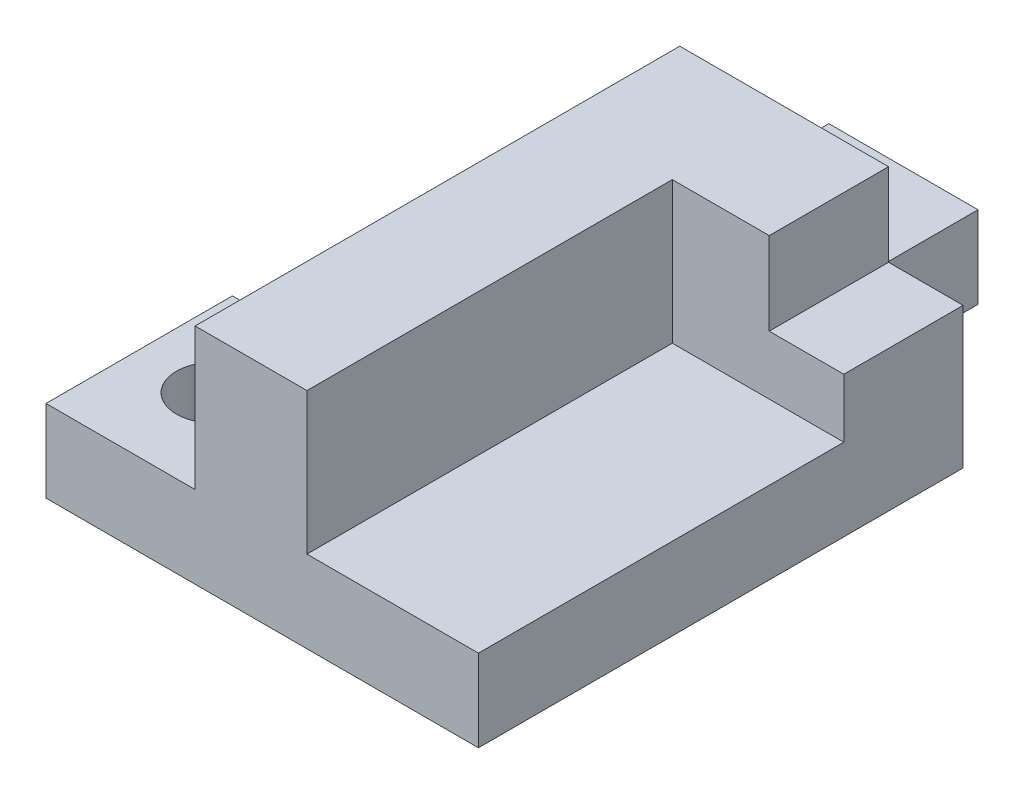
from build123d import *

# Parameters (mm, degrees)
SKETCH1_W               = 369
SKETCH1_H               = 200
BOSS_EXTRUDE1_DEPTH     = 20
SKETCH2_W               = 129
SKETCH2_H               = 16
BOSS_EXTRUDE2_DEPTH     = 10
SKETCH3_W               = 342
SKETCH3_H               = 168
CUT_EXTRUDE1_DEPTH      = 9
SKETCH4_W               = 100
SKETCH4_H               = 10
BOSS_EXTRUDE3_DEPTH     = 60
CUT_EXTRUDE3_DEPTH      = 10
CUT_EXTRUDE3_DEPTH_BACK = 60
SKETCH10_W              = 404
SKETCH10_H              = 324.796202869
CUT_EXTRUDE4_DEPTH      = 69
CUT_EXTRUDE7_DEPTH      = 274.752168941
CUT_EXTRUDE7_DEPTH_BACK = 274.752168941
SKETCH14_W              = 37
SKETCH14_H              = 34.717467541
SKETCH12_W              = 50
SKETCH12_H              = 11
BOSS_EXTRUDE6_DEPTH     = 20
SKETCH13_R              = 4
CUT_EXTRUDE6_DEPTH      = 229.43215623
CORTAR_EXTRUIR4_DEPTH   = 220
CROQUIS5_W              = 20
CROQUIS5_H              = 11
SALIENTE_EXTRUIR2_DEPTH = 10
CROQUIS6_W              = 20
CROQUIS6_H              = 11
SALIENTE_EXTRUIR3_DEPTH = 20
CROQUIS8_R              = 5
CORTAR_EXTRUIR5_DEPTH   = 48
CROQUIS9_W              = 38
CROQUIS9_H              = 65
CORTAR_EXTRUIR6_DEPTH   = 85


with BuildPart() as part:
    # Sketch1 → Boss-Extrude1 (new body)
    with BuildSketch(Plane(origin=(0, 0, 0), x_dir=(1, 0, 0), z_dir=(0, 1, 0))):
        Rectangle(SKETCH1_W, SKETCH1_H)
    extrude(amount=BOSS_EXTRUDE1_DEPTH)

    # Sketch2 → Boss-Extrude2 (add)
    with BuildSketch(Plane(origin=(0, 20, 0), x_dir=(1, 0, 0), z_dir=(0, 1, 0))):
        Polygon((-184.5, -100), (-169.5, -100), (-119.5, -100), (-119.5, -84), (-169.5, -84), (-169.5, -35), (-184.5, -35), align=None)
        Polygon((-184.5, 100), (-169.5, 100), (-119.5, 100), (-119.5, 84), (-169.5, 84), (-169.5, 35), (-184.5, 35), align=None)
        with Locations((20, -92)):
            Rectangle(SKETCH2_W, SKETCH2_H)
        with Locations((20, 92)):
            Rectangle(SKETCH2_W, SKETCH2_H)
    extrude(amount=BOSS_EXTRUDE2_DEPTH)

    # Sketch3 → Cut-Extrude1 (cut)
    with BuildSketch(Plane(origin=(0, 20, 0), x_dir=(1, 0, 0), z_dir=(0, 1, 0))):
        with Locations((1.5, 0)):
            Rectangle(SKETCH3_W, SKETCH3_H)
    extrude(amount=-CUT_EXTRUDE1_DEPTH, mode=Mode.SUBTRACT)

    # Sketch4 → Boss-Extrude3 (add)
    with BuildSketch(Plane(origin=(0, 0, -100), x_dir=(-1, 0, 0), z_dir=(0, 0, -1))):
        with Locations((-19.5, 25)):
            Rectangle(SKETCH4_W, SKETCH4_H)
    extrude(amount=BOSS_EXTRUDE3_DEPTH)

    # Sketch6 → Cut-Extrude3 (cut, two sides: drawn at the far end of the back side and taken through both)
    with BuildSketch(Plane.XY.offset(-84).offset(-CUT_EXTRUDE3_DEPTH_BACK)):
        with BuildLine():
            Line((-24.5, 30), (-26.030765637, 28.081051534))
            ThreePointArc((-26.030765637, 28.081051534), (-26.158442873, 26.948989892), (-25.193843525, 26.342843758))
            Line((-25.193843525, 26.342843758), (-15.806155854, 26.342843758))
            ThreePointArc((-15.806155854, 26.342843758), (-14.841556992, 26.948990172), (-14.969234363, 28.081051534))
            Line((-14.969234363, 28.081051534), (-16.5, 30))
            Line((-16.5, 30), (-24.5, 30))
        make_face()
        with BuildLine():
            Line((56.5, 30), (54.981983491, 27.801494438))
            ThreePointArc((54.981983491, 27.801494438), (54.9192914, 26.767046688), (55.80615587, 26.230871478))
            Line((55.80615587, 26.230871478), (65.193843541, 26.230871478))
            ThreePointArc((65.193843541, 26.230871478), (66.080708464, 26.767046428), (66.018016509, 27.801494438))
            Line((66.018016509, 27.801494438), (64.5, 30))
            Line((64.5, 30), (56.5, 30))
        make_face()
    extrude(amount=CUT_EXTRUDE3_DEPTH + CUT_EXTRUDE3_DEPTH_BACK, mode=Mode.SUBTRACT)

    # Sketch10 → Cut-Extrude4 (cut)
    with BuildSketch(Plane(origin=(0, 30, 0), x_dir=(1, 0, 0), z_dir=(0, 1, 0))):
        with Locations((55.5, -0.89352463)):
            Rectangle(SKETCH10_W, SKETCH10_H)
    extrude(amount=-CUT_EXTRUDE4_DEPTH, mode=Mode.SUBTRACT)

    # Sketch14 → Cut-Extrude7 (cut, two sides: drawn at the far end of the back side and taken through both)
    with BuildSketch(Plane(origin=(0, 0, -100), x_dir=(-1, 0, 0), z_dir=(0, 0, -1)).offset(-CUT_EXTRUDE7_DEPTH_BACK)):
        with Locations((138, 36.253686327)):
            Rectangle(SKETCH14_W, SKETCH14_H)
    extrude(amount=CUT_EXTRUDE7_DEPTH + CUT_EXTRUDE7_DEPTH_BACK, mode=Mode.SUBTRACT)

    # Sketch12 → Boss-Extrude6 (add)
    with BuildSketch(Plane.ZY.offset(184.5)):
        with Locations((-25, 5.5)):
            Rectangle(SKETCH12_W, SKETCH12_H)
    extrude(amount=BOSS_EXTRUDE6_DEPTH)

    # Sketch13 → Cut-Extrude6 (cut, through all)
    with BuildSketch(Plane(origin=(0, 11, 0), x_dir=(1, 0, 0), z_dir=(0, 1, 0))):
        with Locations(Location((-194.5, 25, 0), (0, 0, 270))):
            Circle(SKETCH13_R)
    extrude(amount=-CUT_EXTRUDE6_DEPTH, mode=Mode.SUBTRACT)

    # Croquis3 → Cortar-Extruir4 (cut)
    with BuildSketch(Plane(origin=(0, 30, 0), x_dir=(1, 0, 0), z_dir=(0, 1, 0))):
        Polygon((-169.5, -35), (-146.5, -35), (-146.5, 0), (-146.5, 35), (-204.5, 35), (-204.5, 0), (-204.5, -35), (-184.5, -35), align=None)
    extrude(amount=-CORTAR_EXTRUIR4_DEPTH, mode=Mode.SUBTRACT)


with BuildPart() as cortar_extruir4_piece_1:
    # of the separate pieces the step leaves, piece 1, a body of its own (cortar_extruir4_pieces)
    add(part.part.solids().sort_by_distance((-184.5, 30, -100))[0])

    # Croquis5 → Saliente-Extruir2 (add)
    with BuildSketch(Plane(origin=(0, 0, -50), x_dir=(-1, 0, 0), z_dir=(0, 0, -1))):
        with Locations((194.5, 5.5)):
            Rectangle(CROQUIS5_W, CROQUIS5_H)
    extrude(amount=SALIENTE_EXTRUIR2_DEPTH)

    # Croquis6 → Saliente-Extruir3 (add)
    with BuildSketch(Plane(origin=(0, 0, -100), x_dir=(-1, 0, 0), z_dir=(0, 0, -1))):
        with Locations((174.5, 5.5)):
            Rectangle(CROQUIS6_W, CROQUIS6_H)
    extrude(amount=SALIENTE_EXTRUIR3_DEPTH)

    # Croquis8 → Cortar-Extruir5 (cut)
    with BuildSketch(Plane(origin=(0, 11, 0), x_dir=(1, 0, 0), z_dir=(0, 1, 0))):
        with Locations(Location((-194.5, 47.5, 0), (0, 0, 270))):
            Circle(CROQUIS8_R)
        with Locations((-194.5, -47.5)):
            Circle(CROQUIS8_R)
        with Locations((-174.5, -110)):
            Circle(CROQUIS8_R)
        with Locations(Location((-174.5, 110, 0), (0, 0, 270))):
            Circle(CROQUIS8_R)
    extrude(amount=-CORTAR_EXTRUIR5_DEPTH, mode=Mode.SUBTRACT)


with BuildPart() as cortar_extruir4_piece_2:
    # of the separate pieces the step leaves, piece 2, a body of its own (cortar_extruir4_pieces)
    add(part.part.solids().sort_by_distance((-184.5, 30, 100))[0])

    # Croquis9 → Cortar-Extruir6 (cut)
    with BuildSketch(Plane(origin=(0, 30, 0), x_dir=(1, 0, 0), z_dir=(0, 1, 0))):
        with Locations((-165.5, -67.5)):
            Rectangle(CROQUIS9_W, CROQUIS9_H)
    extrude(amount=-CORTAR_EXTRUIR6_DEPTH, mode=Mode.SUBTRACT)


solid = cortar_extruir4_piece_1.part
